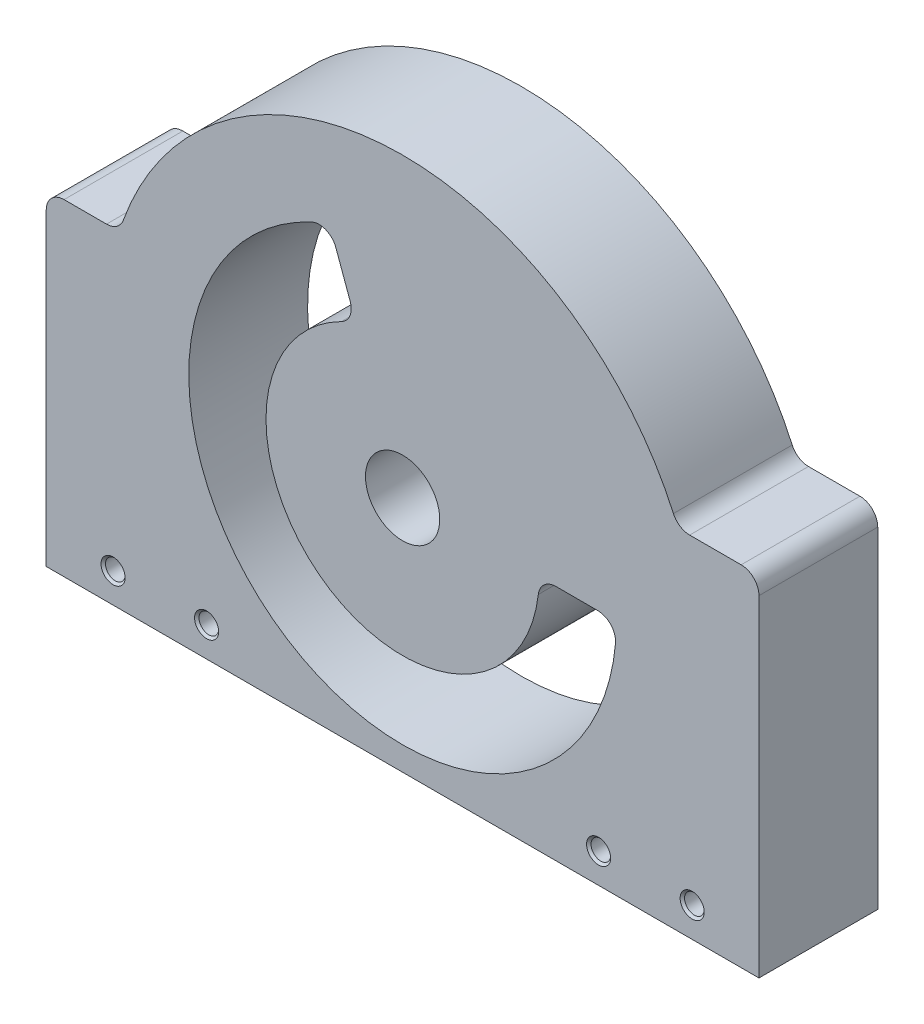
from build123d import *

# Parameters (mm, degrees)
SKIZZE1_R                       = 6.25
AUFSATZ_LINEAR_AUSTRAGEN1_DEPTH = 20
SKIZZE4_R                       = 13
SCHNITT_LINEAR_AUSTRAGEN2_DEPTH = 8
SCHNITT_LINEAR_AUSTRAGEN3_DEPTH = 34.3
VERRUNDUNG1_R                   = 3
VERRUNDUNG2_R                   = 3
SKIZZE7_R                       = 1
SCHNITT_LINEAR_AUSTRAGEN5_DEPTH = 15
M4_GEWINDEBOHRUNG3_D            = 3.3
M4_GEWINDEBOHRUNG3_DEPTH        = 11.5
M4_GEWINDEBOHRUNG3_CSINK_D      = 4.25
M4_GEWINDEBOHRUNG3_CSINK_ANGLE  = 90
M4_GEWINDEBOHRUNG3_TIP          = 0.991420021
M4_GEWINDEBOHRUNG4_D            = 3.3
M4_GEWINDEBOHRUNG4_DEPTH        = 11.5
M4_GEWINDEBOHRUNG4_CSINK_D      = 4.05
M4_GEWINDEBOHRUNG4_CSINK_ANGLE  = 90
M4_GEWINDEBOHRUNG4_TIP          = 0.991420021


with BuildPart() as part:
    # Skizze1 → Aufsatz-Linear austragen1 (new body)
    with BuildSketch(Plane.XY):
        with BuildLine():
            Line((0, 0), (120, 0))
            Line((120, 0), (120, 58.75))
            Line((120, 58.75), (106.351240544, 58.75))
            ThreePointArc((106.351240544, 58.75), (58.007924384, 89.960300587), (12.303039929, 55))
            Line((12.303039929, 55), (0, 55))
            Line((0, 55), (0, 0))
        make_face()
        with Locations((60, 40)):
            Circle(SKIZZE1_R, mode=Mode.SUBTRACT)
    extrude(amount=AUFSATZ_LINEAR_AUSTRAGEN1_DEPTH)

    # Skizze4 → Schnitt-Linear austragen2 (cut)
    with BuildSketch(Plane(origin=(0, 0, 0), x_dir=(-1, 0, 0), z_dir=(0, 0, -1))):
        with Locations((-60, 40)):
            Circle(SKIZZE4_R)
    extrude(amount=-SCHNITT_LINEAR_AUSTRAGEN2_DEPTH, mode=Mode.SUBTRACT)

    # Skizze5 → Schnitt-Linear austragen3 (cut)
    with BuildSketch(Plane(origin=(0, 0, 0), x_dir=(-1, 0, 0), z_dir=(0, 0, -1))):
        with BuildLine():
            Line((-96, 40), (-83, 40))
            ThreePointArc((-83, 40), (-46.807741964, 21.159502981), (-52.133536704, 61.612930278))
            Line((-52.133536704, 61.612930278), (-47.68727484, 73.828934348))
            ThreePointArc((-47.68727484, 73.828934348), (-39.351248291, 10.510526406), (-96, 40))
        make_face()
    extrude(amount=-SCHNITT_LINEAR_AUSTRAGEN3_DEPTH, mode=Mode.SUBTRACT)

    # Verrundung1
    verrundung1_edges = [part.edges().sort_by_distance(p)[0] for p in [
        (47.68727484, 73.828934348, 10),
        (96, 40, 10),
        (83, 40, 10),
        (52.133536704, 61.612930278, 10),
    ]]
    fillet(verrundung1_edges, radius=VERRUNDUNG1_R)

    # Verrundung2
    verrundung2_edges = [part.edges().sort_by_distance(p)[0] for p in [
        (0, 55, 10),
        (12.303039929, 55, 10),
        (106.351240544, 58.75, 10),
        (120, 58.75, 10),
    ]]
    fillet(verrundung2_edges, radius=VERRUNDUNG2_R)

    # Skizze7 → Schnitt-Linear austragen5 (cut)
    with BuildSketch(Plane(origin=(0, 0, 0), x_dir=(-1, 0, 0), z_dir=(0, 0, -1))):
        with Locations((-72.0838337, 50.8848961)):
            Circle(SKIZZE7_R)
        with Locations((-49.1151039, 52.0838337)):
            Circle(SKIZZE7_R)
        with Locations((-70.8848961, 27.9161663)):
            Circle(SKIZZE7_R)
        with Locations((-47.9161663, 29.1151039)):
            Circle(SKIZZE7_R)
    extrude(amount=-SCHNITT_LINEAR_AUSTRAGEN5_DEPTH, mode=Mode.SUBTRACT)

    # M4 Gewindebohrung3
    with Locations(Plane(origin=(72.0838337, 50.8848961, 0), x_dir=(-1, 0, 0), z_dir=(0, 0, -1))):
        with Locations((0, 0), (22.9687298, 1.1989376), (24.1676674, -21.7697922), (1.1989376, -22.9687298)):
            CounterSinkHole(M4_GEWINDEBOHRUNG3_D / 2, M4_GEWINDEBOHRUNG3_CSINK_D / 2, depth=M4_GEWINDEBOHRUNG3_DEPTH, counter_sink_angle=M4_GEWINDEBOHRUNG3_CSINK_ANGLE)
            with Locations((0, 0, -(M4_GEWINDEBOHRUNG3_DEPTH + M4_GEWINDEBOHRUNG3_TIP / 2))):  # 118° drill point
                Cone(0, M4_GEWINDEBOHRUNG3_D / 2, M4_GEWINDEBOHRUNG3_TIP, mode=Mode.SUBTRACT)

    # M4 Gewindebohrung4
    with Locations(Plane(origin=(11.25, 5, 20), x_dir=(1, 0, 0), z_dir=(0, 0, 1))):
        with Locations((0, 0), (15.75, 0), (81.75, 0), (97.5, 0)):
            CounterSinkHole(M4_GEWINDEBOHRUNG4_D / 2, M4_GEWINDEBOHRUNG4_CSINK_D / 2, depth=M4_GEWINDEBOHRUNG4_DEPTH, counter_sink_angle=M4_GEWINDEBOHRUNG4_CSINK_ANGLE)
            with Locations((0, 0, -(M4_GEWINDEBOHRUNG4_DEPTH + M4_GEWINDEBOHRUNG4_TIP / 2))):  # 118° drill point
                Cone(0, M4_GEWINDEBOHRUNG4_D / 2, M4_GEWINDEBOHRUNG4_TIP, mode=Mode.SUBTRACT)


solid = part.part
